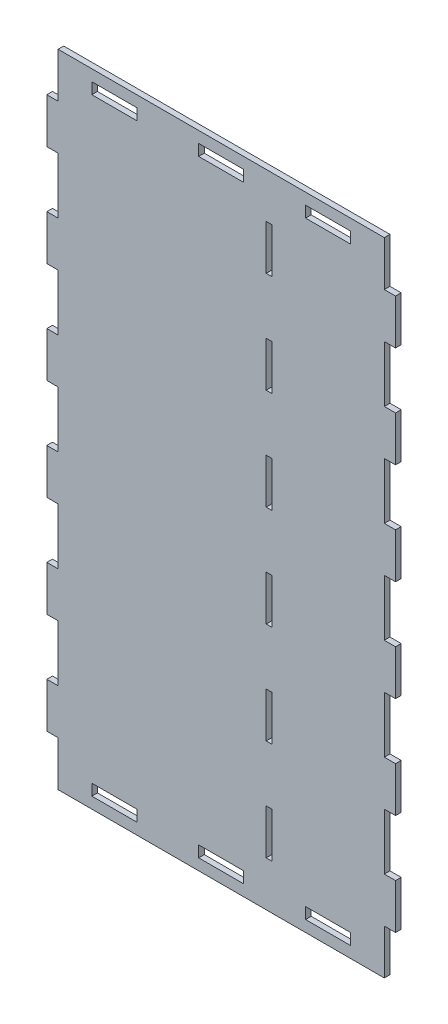
from build123d import *

# Parameters (mm, degrees)
SKETCH1_W           = 20
SKETCH1_H           = 5
SKETCH1_W_2         = 2.5
SKETCH1_H_2         = 20
BOSS_EXTRUDE1_DEPTH = 2.5


with BuildPart() as part:
    # Sketch1 → Boss-Extrude1 (new body)
    with BuildSketch(Plane.XY):
        Polygon((-72.5, 122.5), (-77.5, 122.5), (-77.5, 102.5), (-72.5, 102.5), (-72.5, 77.5), (-77.5, 77.5), (-77.5, 57.5), (-72.5, 57.5), (-72.5, 32.5), (-77.5, 32.5), (-77.5, 12.5), (-72.5, 12.5), (-72.5, -12.5), (-77.5, -12.5), (-77.5, -32.5), (-72.5, -32.5), (-72.5, -57.5), (-77.5, -57.5), (-77.5, -77.5), (-72.5, -77.5), (-72.5, -102.5), (-77.5, -102.5), (-77.5, -122.5), (-72.5, -122.5), (-72.5, -142.5), (72.5, -142.5), (72.5, -122.5), (77.5, -122.5), (77.5, -102.5), (72.5, -102.5), (72.5, -77.5), (77.5, -77.5), (77.5, -57.5), (72.5, -57.5), (72.5, -32.5), (77.5, -32.5), (77.5, -12.5), (72.5, -12.5), (72.5, 12.5), (77.5, 12.5), (77.5, 32.5), (72.5, 32.5), (72.5, 57.5), (77.5, 57.5), (77.5, 77.5), (72.5, 77.5), (72.5, 102.5), (77.5, 102.5), (77.5, 122.5), (72.5, 122.5), (72.5, 142.5), (-72.5, 142.5), align=None)
        with Locations((-47.5, 135)):
            Rectangle(SKETCH1_W, SKETCH1_H, mode=Mode.SUBTRACT)
        with Locations((-47.5, -135)):
            Rectangle(SKETCH1_W, SKETCH1_H, mode=Mode.SUBTRACT)
        with Locations((0, 135)):
            Rectangle(SKETCH1_W, SKETCH1_H, mode=Mode.SUBTRACT)
        with Locations((0, -135)):
            Rectangle(SKETCH1_W, SKETCH1_H, mode=Mode.SUBTRACT)
        with Locations((47.5, 135)):
            Rectangle(SKETCH1_W, SKETCH1_H, mode=Mode.SUBTRACT)
        with Locations((47.5, -135)):
            Rectangle(SKETCH1_W, SKETCH1_H, mode=Mode.SUBTRACT)
        with Locations((21.25, 67.5)):
            Rectangle(SKETCH1_W_2, SKETCH1_H_2, mode=Mode.SUBTRACT)
        with Locations((21.25, 112.5)):
            Rectangle(SKETCH1_W_2, SKETCH1_H_2, mode=Mode.SUBTRACT)
        with Locations((21.25, 22.5)):
            Rectangle(SKETCH1_W_2, SKETCH1_H_2, mode=Mode.SUBTRACT)
        with Locations((21.25, -22.5)):
            Rectangle(SKETCH1_W_2, SKETCH1_H_2, mode=Mode.SUBTRACT)
        with Locations((21.25, -67.5)):
            Rectangle(SKETCH1_W_2, SKETCH1_H_2, mode=Mode.SUBTRACT)
        with Locations((21.25, -112.5)):
            Rectangle(SKETCH1_W_2, SKETCH1_H_2, mode=Mode.SUBTRACT)
    extrude(amount=BOSS_EXTRUDE1_DEPTH)


solid = part.part
